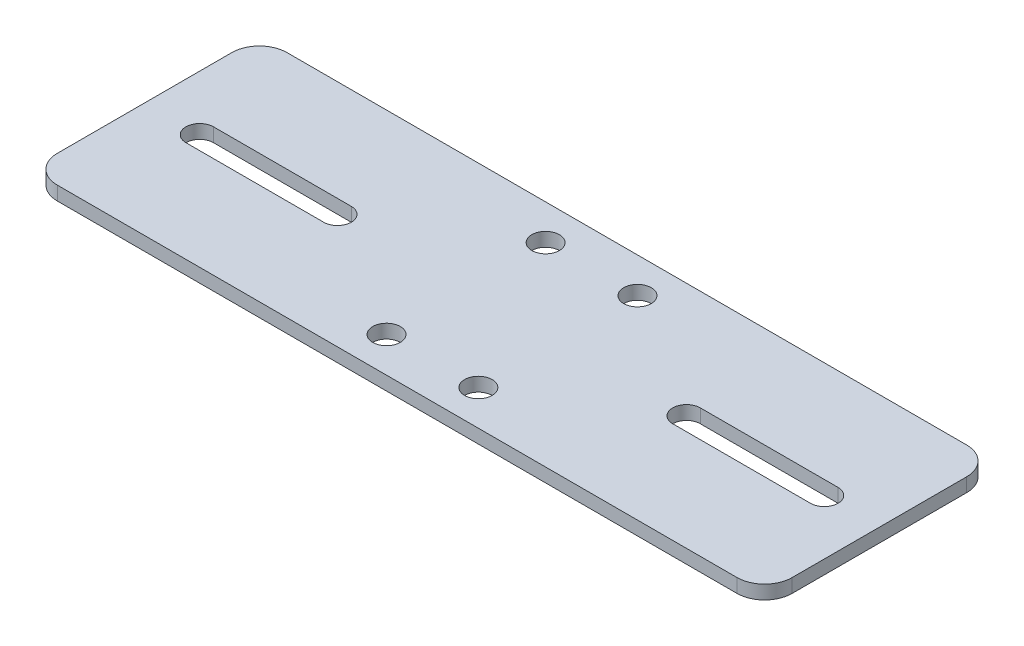
from build123d import *

# Parameters (mm, degrees)
SKETCH2_W           = 80
SKETCH2_H           = 25
SKETCH2_R           = 1.5
BOSS_EXTRUDE1_DEPTH = 1.5
FILLET2_R           = 3


with BuildPart() as part:
    # Sketch2 → Boss-Extrude1 (new body)
    with BuildSketch(Plane(origin=(0, 0, 0), x_dir=(1, 0, 0), z_dir=(0, 1, 0))):
        Rectangle(SKETCH2_W, SKETCH2_H)
        with Locations(Location((5, -8.660254038, 0), (0, 0, 270))):
            Circle(SKETCH2_R, mode=Mode.SUBTRACT)
        with Locations(Location((-5, -8.660254038, 0), (0, 0, 270))):
            Circle(SKETCH2_R, mode=Mode.SUBTRACT)
        with Locations(Location((-5, 8.660254038, 0), (0, 0, 270))):
            Circle(SKETCH2_R, mode=Mode.SUBTRACT)
        with Locations(Location((5, 8.660254038, 0), (0, 0, 270))):
            Circle(SKETCH2_R, mode=Mode.SUBTRACT)
        with BuildLine():
            Line((34, -1.5), (19, -1.5))
            ThreePointArc((19, -1.5), (17.5, 0), (19, 1.5))
            Line((19, 1.5), (34, 1.5))
            ThreePointArc((34, 1.5), (35.5, 0), (34, -1.5))
        make_face(mode=Mode.SUBTRACT)
        with BuildLine():
            Line((-34, -1.5), (-19, -1.5))
            ThreePointArc((-19, -1.5), (-17.5, 0), (-19, 1.5))
            Line((-19, 1.5), (-34, 1.5))
            ThreePointArc((-34, 1.5), (-35.5, 0), (-34, -1.5))
        make_face(mode=Mode.SUBTRACT)
    extrude(amount=-BOSS_EXTRUDE1_DEPTH)

    # Fillet2
    fillet2_edges = [part.edges().sort_by_distance(p)[0] for p in [
        (40, -0.75, 12.5),
        (-40, -0.75, 12.5),
        (-40, -0.75, -12.5),
        (40, -0.75, -12.5),
    ]]
    fillet(fillet2_edges, radius=FILLET2_R)


solid = part.part
